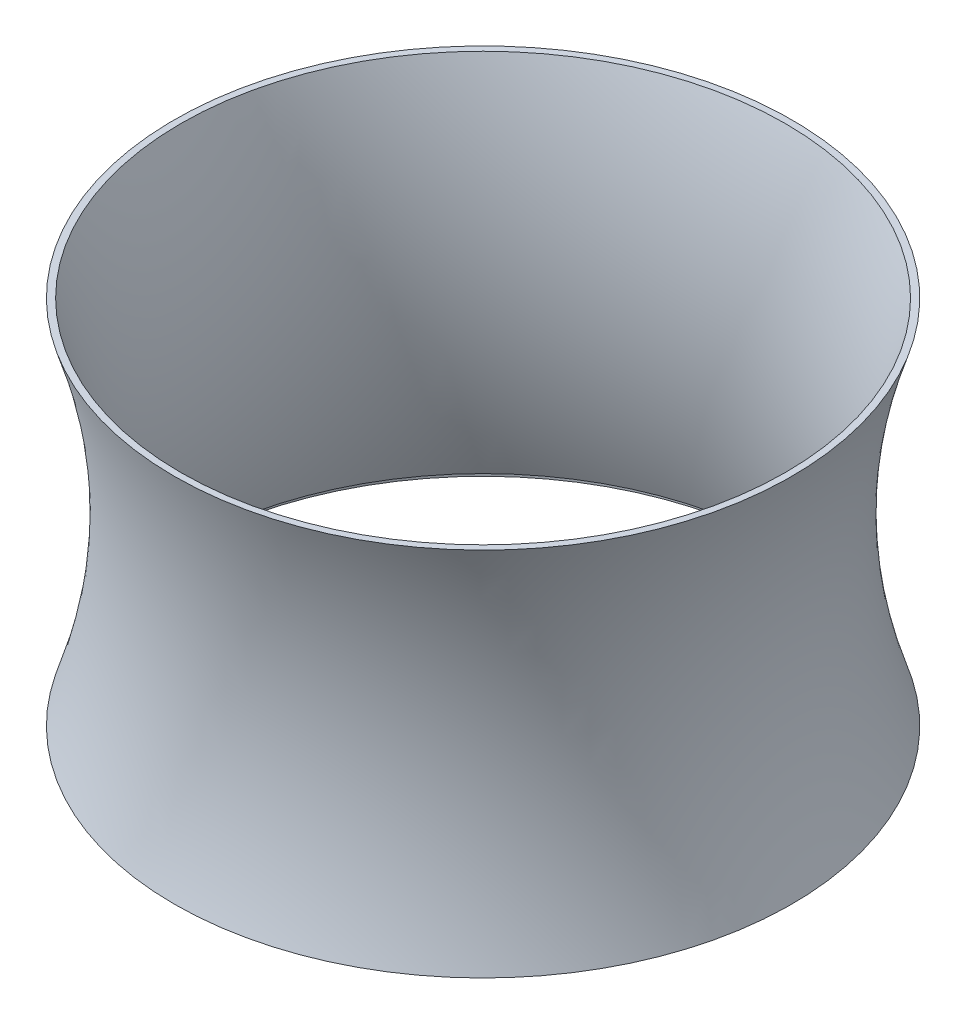
from build123d import *

# Parameters (mm, degrees)
SHELL_1_T           = -1
SKETCH_2_R          = 49.5
CUT_EXTRUDE_1_DEPTH = 1


with BuildPart() as part:
    # 草图1 → 旋转1 (revolve)
    with BuildSketch(Plane.XY):
        with BuildLine():
            Line((0, 30), (0, -30))
            Line((0, -30), (-50, -30))
            add(Edge.make_bspline(
                [(-50, 30), (-40, 0), (-50, -30)],
                knots=[0, 0, 0, 1, 1, 1], degree=2))
            Line((-50, 30), (0, 30))
        make_face()
    revolve(axis=Axis((0, 30, 0), (0, -1, 0)))

    # 抽壳1
    shell_1_openings = [part.faces().sort_by_distance(p)[0] for p in [
        (0, 30, 0),
    ]]
    offset(amount=SHELL_1_T, openings=shell_1_openings, kind=Kind.INTERSECTION)

    # 草图2 → 切除-拉伸1 (cut)
    with BuildSketch(Plane.XZ.offset(30)):
        with Locations(Location((0, 0, 0), (0, 0, 270))):
            Circle(SKETCH_2_R)
    extrude(amount=-CUT_EXTRUDE_1_DEPTH, mode=Mode.SUBTRACT)


solid = part.part
